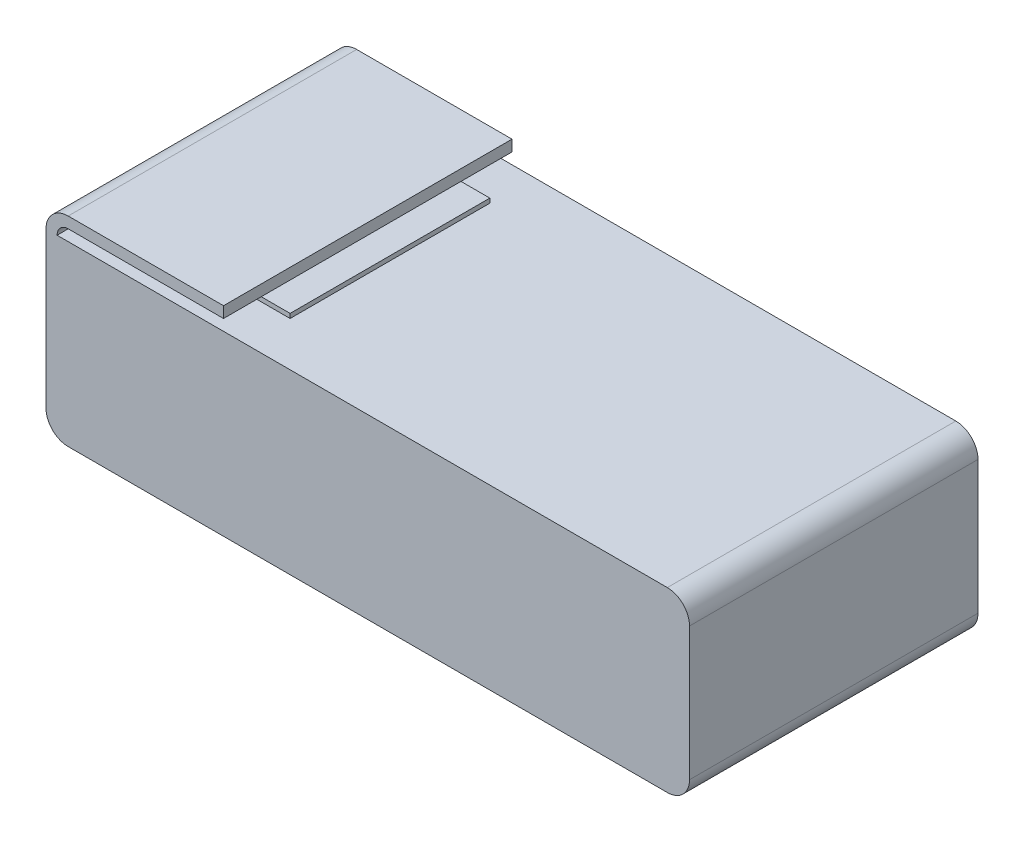
from build123d import *

# Parameters (mm, degrees)
BOSS_EXTRUDE1_DEPTH = 32.5
BOSS_EXTRUDE2_DEPTH = 2.5
SKETCH3_W           = 15
SKETCH3_H           = 45
BOSS_EXTRUDE3_DEPTH = 1
SKETCH4_W           = 25
SKETCH4_H           = 55
BOSS_EXTRUDE4_DEPTH = 1


with BuildPart() as part:
    # Sketch1 → Boss-Extrude1 (new, symmetric)
    with BuildSketch(Plane.XY):
        with BuildLine():
            Line((5, 0), (140, 0))
            ThreePointArc((140, 0), (143.535533906, 1.464466094), (145, 5))
            Line((145, 5), (145, 35))
            ThreePointArc((145, 35), (143.535533906, 38.535533906), (140, 40))
            Line((140, 40), (10, 40))
            Line((10, 40), (10, 37.5))
            Line((10, 37.5), (140, 37.5))
            ThreePointArc((140, 37.5), (141.767766953, 36.767766953), (142.5, 35))
            Line((142.5, 35), (142.5, 5))
            ThreePointArc((142.5, 5), (141.767766953, 3.232233047), (140, 2.5))
            Line((140, 2.5), (5, 2.5))
            ThreePointArc((5, 2.5), (3.232233047, 3.232233047), (2.5, 5))
            Line((2.5, 5), (2.5, 40))
            ThreePointArc((2.5, 40), (3.232233047, 41.767766953), (5, 42.5))
            Line((5, 42.5), (40, 42.5))
            Line((40, 42.5), (40, 45))
            Line((40, 45), (5, 45))
            ThreePointArc((5, 45), (1.464466094, 43.535533906), (0, 40))
            Line((0, 40), (0, 5))
            ThreePointArc((0, 5), (1.464466094, 1.464466094), (5, 0))
        make_face()
    extrude(amount=BOSS_EXTRUDE1_DEPTH, both=True)

    # Sketch2 → Boss-Extrude2 (add)
    with BuildSketch(Plane.XY.offset(32.5)):
        with BuildLine():
            Line((0, 40), (0, 5))
            ThreePointArc((0, 5), (1.464466094, 1.464466094), (5, 0))
            Line((5, 0), (140, 0))
            ThreePointArc((140, 0), (143.535533906, 1.464466094), (145, 5))
            Line((145, 5), (145, 35))
            ThreePointArc((145, 35), (143.535533906, 38.535533906), (140, 40))
            Line((140, 40), (0, 40))
        make_face()
    boss_extrude2 = extrude(amount=-BOSS_EXTRUDE2_DEPTH)

    # Mirror1: Boss-Extrude2 across plane
    add(boss_extrude2.mirror(Plane.XY))

    # Sketch3 → Boss-Extrude3 (add)
    with BuildSketch(Plane(origin=(0, 40, 0), x_dir=(1, 0, 0), z_dir=(0, 1, 0))):
        with Locations((37.5, 0)):
            Rectangle(SKETCH3_W, SKETCH3_H)
    extrude(amount=BOSS_EXTRUDE3_DEPTH)

    # Sketch4 → Boss-Extrude4 (add)
    with BuildSketch(Plane.XZ):
        with Locations((22.5, 0)):
            Rectangle(SKETCH4_W, SKETCH4_H)
        with Locations((122.5, 0)):
            Rectangle(SKETCH4_W, SKETCH4_H)
    extrude(amount=BOSS_EXTRUDE4_DEPTH)


solid = part.part
